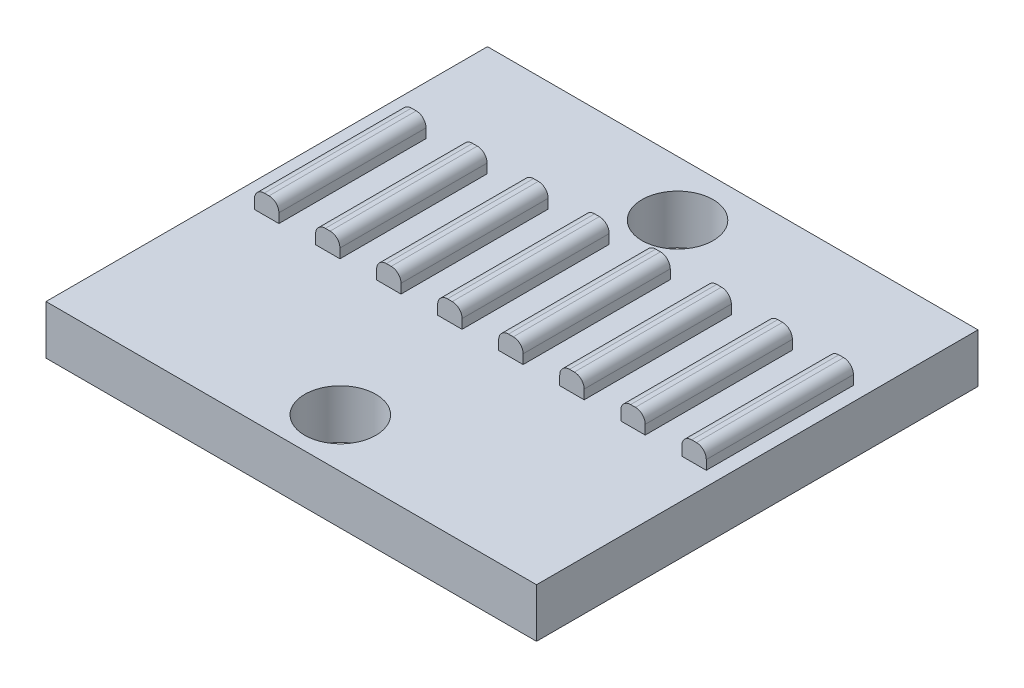
from build123d import *

# Parameters (mm, degrees)
SKETCH_1_W          = 20
SKETCH_1_H          = 18
EXTRUDE_1_DEPTH     = 2
SKETCH_2_R          = 1.45
CUT_EXTRUDE_1_DEPTH = 2
SKETCH_6_W          = 0.995744681
SKETCH_6_H          = 6
EXTRUDE_4_DEPTH     = 0.78
EXTRUDE_4_2_DEPTH   = 0.78
SKETCH_6_W_2        = 0.99574468
EXTRUDE_4_3_DEPTH   = 0.78
EXTRUDE_4_4_DEPTH   = 0.78
EXTRUDE_4_5_DEPTH   = 0.78
EXTRUDE_4_6_DEPTH   = 0.78
EXTRUDE_4_7_DEPTH   = 0.78
EXTRUDE_4_8_DEPTH   = 0.78
FILLET_11_R         = 0.4
FILLET_12_R         = 0.4
FILLET_13_R         = 0.4
FILLET_14_R         = 0.4
FILLET_15_R         = 0.4
FILLET_16_R         = 0.4
FILLET_17_R         = 0.4
FILLET_18_R         = 0.4
FILLET_19_R         = 0.4


with BuildPart() as part:
    # 草图1 → 凸台-拉伸1 (new body)
    with BuildSketch(Plane(origin=(0, 0, 0), x_dir=(1, 0, 0), z_dir=(0, 1, 0))):
        Rectangle(SKETCH_1_W, SKETCH_1_H)
    extrude(amount=EXTRUDE_1_DEPTH)

    # 草图2 → 切除-拉伸1 (cut)
    with BuildSketch(Plane(origin=(-240.647809903, 2, 128.997706918), x_dir=(-0.03789144558413265, 0, 0.9992818613141864), z_dir=(0, 1, 0))):
        with Locations(Location((-131.028589039, 235.852321928, 0), (0, 0, 2.171539759))):
            Circle(SKETCH_2_R)
        with Locations(Location((-144.768714632, 235.331314552, 0), (0, 0, 2.171539759))):
            Circle(SKETCH_2_R)
    extrude(amount=-CUT_EXTRUDE_1_DEPTH, mode=Mode.SUBTRACT)


with BuildPart() as body_2:
    # 草图6 → 凸台-拉伸4 (new body)
    with BuildSketch(Plane(origin=(0, 2, 0), x_dir=(1, 0, 0), z_dir=(0, 1, 0))):
        with Locations((8.923404255, 1.5)):
            Rectangle(SKETCH_6_W, SKETCH_6_H)
    extrude(amount=EXTRUDE_4_DEPTH)

    # 圆角19
    fillet_19_edges = [body_2.edges().sort_by_distance(p)[0] for p in [
        (8.425531915, 2.78, -1.5),
        (9.421276596, 2.78, -1.5),
    ]]
    fillet(fillet_19_edges, radius=FILLET_19_R)


with BuildPart() as body_3:
    # 草图6 → Extrude 4 2 (new body)
    with BuildSketch(Plane(origin=(0, 2, 0), x_dir=(1, 0, 0), z_dir=(0, 1, 0))):
        with Locations((6.434042554, 1.5)):
            Rectangle(SKETCH_6_W, SKETCH_6_H)
    extrude(amount=EXTRUDE_4_2_DEPTH)

    # 圆角18
    fillet_18_edges = [body_3.edges().sort_by_distance(p)[0] for p in [
        (5.936170213, 2.78, -1.5),
        (6.931914894, 2.78, -1.5),
    ]]
    fillet(fillet_18_edges, radius=FILLET_18_R)


with BuildPart() as body_4:
    # 草图6 → Extrude 4 3 (new body)
    with BuildSketch(Plane(origin=(0, 2, 0), x_dir=(1, 0, 0), z_dir=(0, 1, 0))):
        with Locations((3.944680851, 1.5)):
            Rectangle(SKETCH_6_W_2, SKETCH_6_H)
    extrude(amount=EXTRUDE_4_3_DEPTH)

    # 圆角17
    fillet_17_edges = [body_4.edges().sort_by_distance(p)[0] for p in [
        (3.446808511, 2.78, -1.5),
        (4.442553191, 2.78, -1.5),
    ]]
    fillet(fillet_17_edges, radius=FILLET_17_R)


with BuildPart() as body_5:
    # 草图6 → Extrude 4 4 (new body)
    with BuildSketch(Plane(origin=(0, 2, 0), x_dir=(1, 0, 0), z_dir=(0, 1, 0))):
        with Locations((1.455319149, 1.5)):
            Rectangle(SKETCH_6_W_2, SKETCH_6_H)
    extrude(amount=EXTRUDE_4_4_DEPTH)

    # 圆角16
    fillet_16_edges = [body_5.edges().sort_by_distance(p)[0] for p in [
        (0.957446809, 2.78, -1.5),
        (1.953191489, 2.78, -1.5),
    ]]
    fillet(fillet_16_edges, radius=FILLET_16_R)


with BuildPart() as body_6:
    # 草图6 → Extrude 4 5 (new body)
    with BuildSketch(Plane(origin=(0, 2, 0), x_dir=(1, 0, 0), z_dir=(0, 1, 0))):
        with Locations((-1.034042553, 1.5)):
            Rectangle(SKETCH_6_W, SKETCH_6_H)
    extrude(amount=EXTRUDE_4_5_DEPTH)

    # 圆角14
    fillet_14_edges = [body_6.edges().sort_by_distance(p)[0] for p in [
        (-1.531914894, 2.78, -1.5),
    ]]
    fillet(fillet_14_edges, radius=FILLET_14_R)

    # 圆角15
    fillet_15_edges = [body_6.edges().sort_by_distance(p)[0] for p in [
        (-0.536170213, 2.78, -1.5),
    ]]
    fillet(fillet_15_edges, radius=FILLET_15_R)


with BuildPart() as body_7:
    # 草图6 → Extrude 4 6 (new body)
    with BuildSketch(Plane(origin=(0, 2, 0), x_dir=(1, 0, 0), z_dir=(0, 1, 0))):
        with Locations((-3.523404256, 1.5)):
            Rectangle(SKETCH_6_W, SKETCH_6_H)
    extrude(amount=EXTRUDE_4_6_DEPTH)

    # 圆角13
    fillet_13_edges = [body_7.edges().sort_by_distance(p)[0] for p in [
        (-4.021276596, 2.78, -1.5),
        (-3.025531915, 2.78, -1.5),
    ]]
    fillet(fillet_13_edges, radius=FILLET_13_R)


with BuildPart() as body_8:
    # 草图6 → Extrude 4 7 (new body)
    with BuildSketch(Plane(origin=(0, 2, 0), x_dir=(1, 0, 0), z_dir=(0, 1, 0))):
        with Locations((-6.012765958, 1.5)):
            Rectangle(SKETCH_6_W, SKETCH_6_H)
    extrude(amount=EXTRUDE_4_7_DEPTH)

    # 圆角12
    fillet_12_edges = [body_8.edges().sort_by_distance(p)[0] for p in [
        (-6.510638298, 2.78, -1.5),
        (-5.514893617, 2.78, -1.5),
    ]]
    fillet(fillet_12_edges, radius=FILLET_12_R)


with BuildPart() as body_9:
    # 草图6 → Extrude 4 8 (new body)
    with BuildSketch(Plane(origin=(0, 2, 0), x_dir=(1, 0, 0), z_dir=(0, 1, 0))):
        with Locations((-8.50212766, 1.5)):
            Rectangle(SKETCH_6_W, SKETCH_6_H)
    extrude(amount=EXTRUDE_4_8_DEPTH)

    # 圆角11
    fillet_11_edges = [body_9.edges().sort_by_distance(p)[0] for p in [
        (-8.004255319, 2.78, -1.5),
        (-9, 2.78, -1.5),
    ]]
    fillet(fillet_11_edges, radius=FILLET_11_R)


solid = Compound([part.part, body_2.part, body_3.part, body_4.part, body_5.part, body_6.part, body_7.part, body_8.part, body_9.part])
